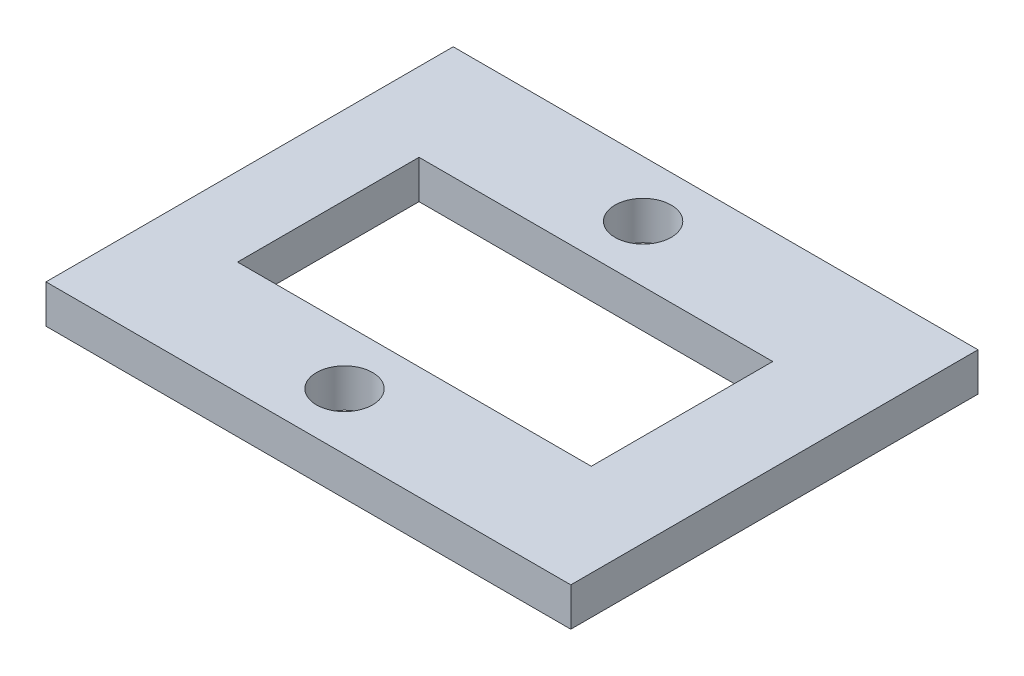
from build123d import *

# Parameters (mm, degrees)
SKETCH2_W           = 34.12443
SKETCH2_H           = 26.478152769
SKETCH2_R           = 1.825
SKETCH2_W_2         = 23
SKETCH2_H_2         = 11.79979
BOSS_EXTRUDE1_DEPTH = 1.25


with BuildPart() as part:
    # Sketch2 → Boss-Extrude1 (new, symmetric)
    with BuildSketch(Plane(origin=(0, 0, 0), x_dir=(1, 0, 0), z_dir=(0, 1, 0))):
        with Locations((0.360723362, 0.777502601)):
            Rectangle(SKETCH2_W, SKETCH2_H)
        with Locations(Location((-0.702610465, 10.366481865, 0), (0, 0, 270))):
            Circle(SKETCH2_R, mode=Mode.SUBTRACT)
        with Locations(Location((-0.97805, -8.773518135, 0), (0, 0, 270))):
            Circle(SKETCH2_R, mode=Mode.SUBTRACT)
        with Locations((-0.088760873, 0.7809876)):
            Rectangle(SKETCH2_W_2, SKETCH2_H_2, mode=Mode.SUBTRACT)
    extrude(amount=BOSS_EXTRUDE1_DEPTH, both=True)


solid = part.part
